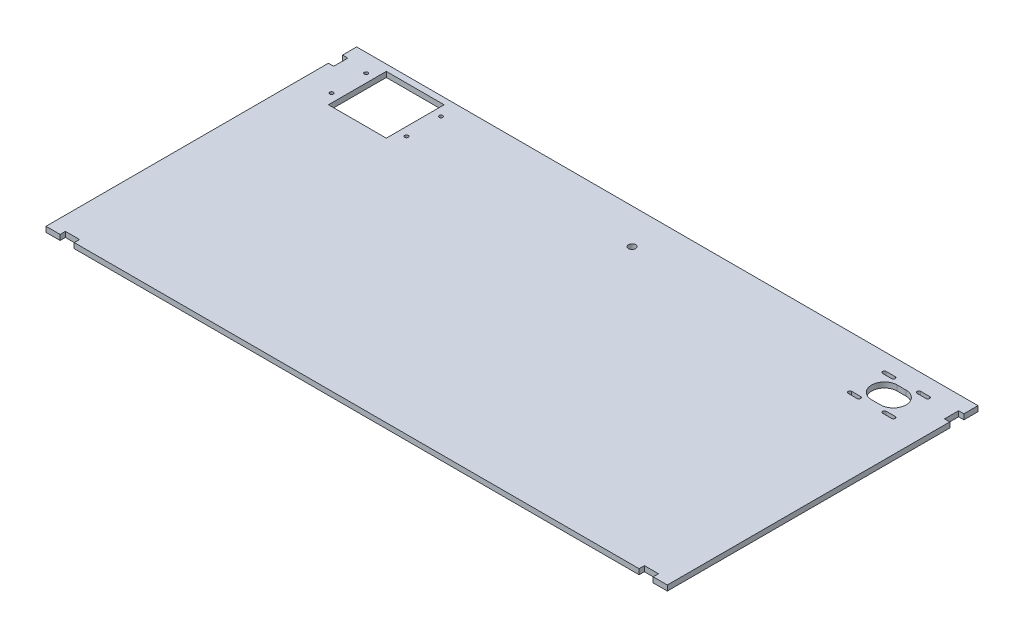
from build123d import *

# Parameters (mm, degrees)
SKETCH1_R           = 3.175
BOSS_EXTRUDE1_DEPTH = 4.7625
SKETCH5_R           = 1.5875
SKETCH5_W           = 51.999999886
SKETCH5_H           = 51.999999886
CUT_EXTRUDE2_DEPTH  = 625.775544821


with BuildPart() as part:
    # Sketch1 → Boss-Extrude1 (new body)
    with BuildSketch(Plane(origin=(0, 0, 0), x_dir=(1, 0, 0), z_dir=(0, 1, 0))):
        Polygon((0, 0), (12.7, 0), (12.7, 4.7625), (25.4, 4.7625), (25.4, 0), (533.4, 0), (533.4, 4.7625), (546.1, 4.7625), (546.1, 0), (558.8, 0), (558.8, 254), (554.0375, 254), (554.0375, 266.7), (558.8, 266.7), (558.8, 279.4), (0, 279.4), (0, 266.7), (4.7625, 266.7), (4.7625, 254), (0, 254), align=None)
        with Locations(Location((279.4, 247.65, 0), (0, 0, 90))):
            Circle(SKETCH1_R, mode=Mode.SUBTRACT)
        with BuildLine():
            Line((38.9, 264.75), (46.9, 264.75))
            ThreePointArc((46.9, 264.75), (48.5, 263.15), (46.9, 261.55))
            Line((46.9, 261.55), (38.9, 261.55))
            ThreePointArc((38.9, 261.55), (37.3, 263.15), (38.9, 264.75))
        make_face(mode=Mode.SUBTRACT)
        with BuildLine():
            Line((69.9, 264.75), (77.9, 264.75))
            ThreePointArc((77.9, 264.75), (79.5, 263.15), (77.9, 261.55))
            Line((77.9, 261.55), (69.9, 261.55))
            ThreePointArc((69.9, 261.55), (68.3, 263.15), (69.9, 264.75))
        make_face(mode=Mode.SUBTRACT)
        with BuildLine():
            Line((38.9, 233.75), (46.9, 233.75))
            ThreePointArc((46.9, 233.75), (48.5, 232.15), (46.9, 230.55))
            Line((46.9, 230.55), (38.9, 230.55))
            ThreePointArc((38.9, 230.55), (37.3, 232.15), (38.9, 233.75))
        make_face(mode=Mode.SUBTRACT)
        with BuildLine():
            Line((69.9, 233.75), (77.9, 233.75))
            ThreePointArc((77.9, 233.75), (79.5, 232.15), (77.9, 230.55))
            Line((77.9, 230.55), (69.9, 230.55))
            ThreePointArc((69.9, 230.55), (68.3, 232.15), (69.9, 233.75))
        make_face(mode=Mode.SUBTRACT)
        with BuildLine():
            Line((490.9, 264.75), (498.9, 264.75))
            ThreePointArc((498.9, 264.75), (500.5, 263.15), (498.9, 261.55))
            Line((498.9, 261.55), (490.9, 261.55))
            ThreePointArc((490.9, 261.55), (489.3, 263.15), (490.9, 264.75))
        make_face(mode=Mode.SUBTRACT)
        with BuildLine():
            Line((490.9, 233.75), (498.9, 233.75))
            ThreePointArc((498.9, 233.75), (500.5, 232.15), (498.9, 230.55))
            Line((498.9, 230.55), (490.9, 230.55))
            ThreePointArc((490.9, 230.55), (489.3, 232.15), (490.9, 233.75))
        make_face(mode=Mode.SUBTRACT)
        with BuildLine():
            Line((521.9, 233.75), (529.9, 233.75))
            ThreePointArc((529.9, 233.75), (531.5, 232.15), (529.9, 230.55))
            Line((529.9, 230.55), (521.9, 230.55))
            ThreePointArc((521.9, 230.55), (520.3, 232.15), (521.9, 233.75))
        make_face(mode=Mode.SUBTRACT)
        with BuildLine():
            Line((529.9, 261.55), (521.9, 261.55))
            ThreePointArc((521.9, 261.55), (520.3, 263.15), (521.9, 264.75))
            Line((521.9, 264.75), (529.9, 264.75))
            ThreePointArc((529.9, 264.75), (531.5, 263.15), (529.9, 261.55))
        make_face(mode=Mode.SUBTRACT)
        with BuildLine():
            Line((54.4, 259.15), (62.4, 259.15))
            ThreePointArc((62.4, 259.15), (73.9, 247.65), (62.4, 236.15))
            Line((62.4, 236.15), (54.4, 236.15))
            ThreePointArc((54.4, 236.15), (42.9, 247.65), (54.4, 259.15))
        make_face(mode=Mode.SUBTRACT)
        with BuildLine():
            Line((506.4, 259.15), (514.4, 259.15))
            ThreePointArc((514.4, 259.15), (525.9, 247.65), (514.4, 236.15))
            Line((514.4, 236.15), (506.4, 236.15))
            ThreePointArc((506.4, 236.15), (494.9, 247.65), (506.4, 259.15))
        make_face(mode=Mode.SUBTRACT)
    extrude(amount=BOSS_EXTRUDE1_DEPTH)

    # Sketch5 → Cut-Extrude2 (cut, through all)
    with BuildSketch(Plane(origin=(0, 4.7625, 0), x_dir=(1, 0, 0), z_dir=(0, 1, 0))):
        with Locations(Location((24.745, 263.144, 0), (0, 0, 270))):
            Circle(SKETCH5_R)
        with Locations(Location((24.745, 232.15, 0), (0, 0, 270))):
            Circle(SKETCH5_R)
        with Locations(Location((92.055, 263.144, 0), (0, 0, 270))):
            Circle(SKETCH5_R)
        with Locations(Location((92.055, 232.15, 0), (0, 0, 270))):
            Circle(SKETCH5_R)
        with Locations((58.4, 247.65)):
            Rectangle(SKETCH5_W, SKETCH5_H)
    extrude(amount=-CUT_EXTRUDE2_DEPTH, mode=Mode.SUBTRACT)


solid = part.part
